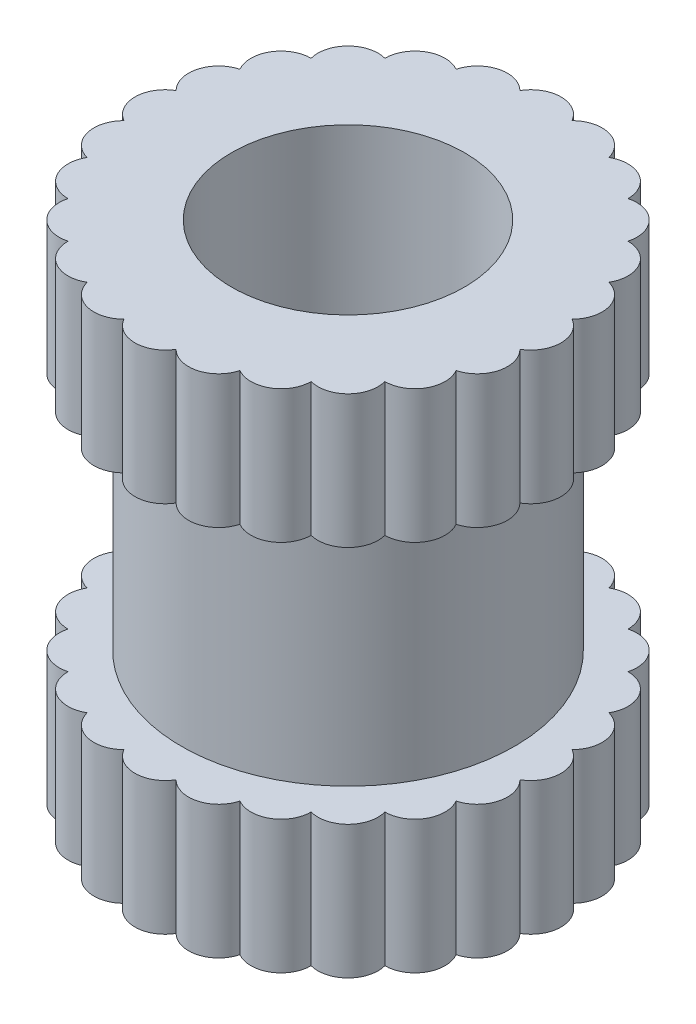
from build123d import *

# Parameters (mm, degrees)
SKETCH1_R           = 1.6
SKETCH1_R_2         = 0.875
BOSS_EXTRUDE1_DEPTH = 3.8
SKETCH2_W           = 0.35
SKETCH2_H           = 1.8
CUT_EXTRUDE1_DEPTH  = 5.422668877
CIRPATTERN1_COUNT   = 24


with BuildPart() as part:
    # Sketch1 → Boss-Extrude1 (new body)
    with BuildSketch(Plane(origin=(0, 0, 0), x_dir=(1, 0, 0), z_dir=(0, 1, 0))):
        with Locations(Location((0, 0, 0), (0, 0, 90))):
            Circle(SKETCH1_R)
        with Locations(Location((0, 0, 0), (0, 0, 90))):
            Circle(SKETCH1_R_2, mode=Mode.SUBTRACT)
    extrude(amount=BOSS_EXTRUDE1_DEPTH)

    # Sketch2 → Cut-Revolve1 (revolve, cut)
    with BuildSketch(Plane(origin=(0, 0, 0), x_dir=(0, 0, -1), z_dir=(1, 0, 0))):
        with Locations((1.425, 1.9)):
            Rectangle(SKETCH2_W, SKETCH2_H)
    revolve(axis=Axis((0, 0, 0), (0, 1, 0)), mode=Mode.SUBTRACT)

    # Sketch3 → Cut-Extrude1 (cut, through all)
    with BuildSketch(Plane(origin=(0, 3.8, 0), x_dir=(1, 0, 0), z_dir=(0, 1, 0))):
        with BuildLine():
            ThreePointArc((0, 1.6), (0.112987461, 1.569772966), (0.195789288, 1.487167292))
            ThreePointArc((0.195789288, 1.487167292), (0.297149633, 1.545527556), (0.414110472, 1.545481322))
            ThreePointArc((0.414110472, 1.545481322), (0.208841908, 1.586311778), (0, 1.6))
        make_face()
    cut_extrude1 = extrude(amount=-CUT_EXTRUDE1_DEPTH, mode=Mode.SUBTRACT)

    # CirPattern1: Cut-Extrude1 ×24 about axis
    cirpattern1_axis = Axis((0, 0, 0), (0, 1, 0))
    for i in range(1, CIRPATTERN1_COUNT):
        add(cut_extrude1.rotate(cirpattern1_axis, i * 360 / CIRPATTERN1_COUNT), mode=Mode.SUBTRACT)


solid = part.part
